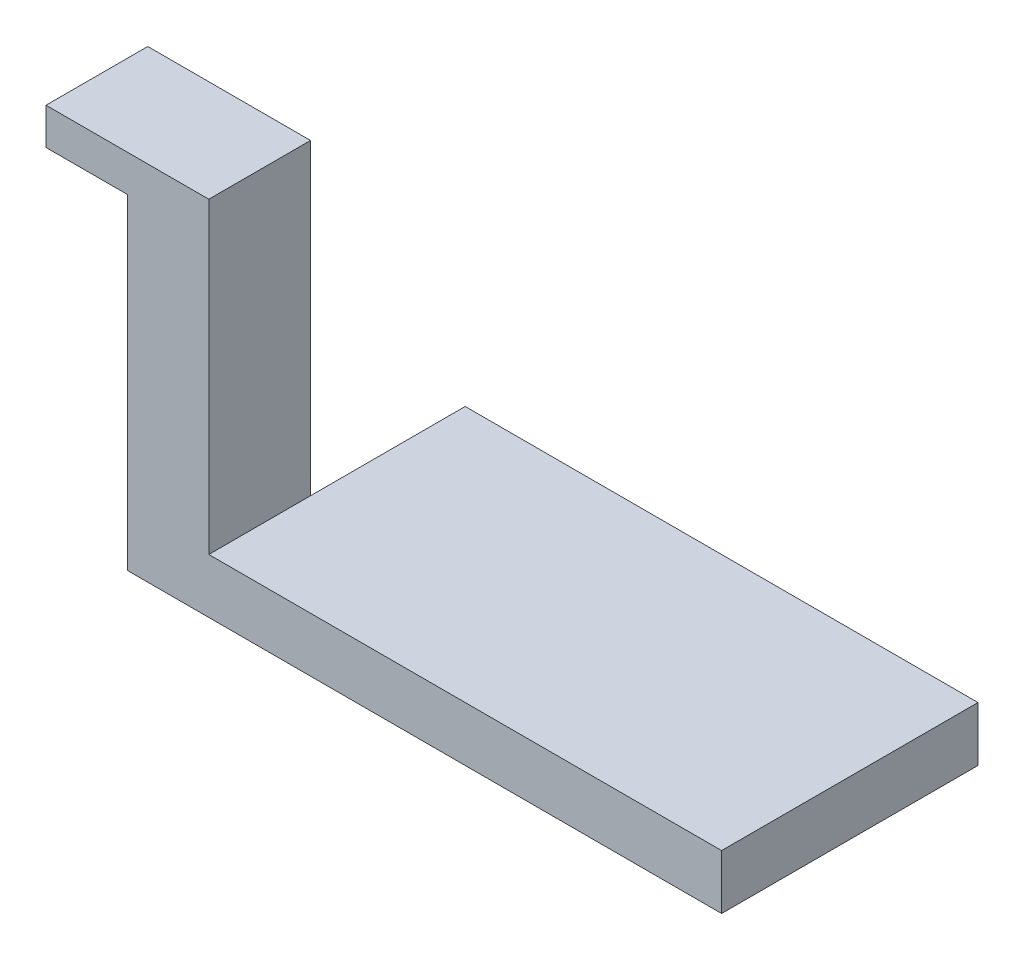
from build123d import *

# Parameters (mm, degrees)
SKETCH1_W           = 10.16
SKETCH1_H           = 6.35
BOSS_EXTRUDE1_DEPTH = 2.286
SKETCH2_W           = 5.842
SKETCH2_H           = 1.651
CUT_EXTRUDE1_DEPTH  = 8.89
SKETCH3_W           = 5.08
SKETCH3_H           = 6.35
BOSS_EXTRUDE2_DEPTH = 20.32
SKETCH4_W           = 16.002
SKETCH4_H           = 3.4036
BOSS_EXTRUDE3_DEPTH = 32.004


with BuildPart() as part:
    # Sketch1 → Boss-Extrude1 (new body)
    with BuildSketch(Plane(origin=(0, 0, 0), x_dir=(1, 0, 0), z_dir=(0, 1, 0))):
        with Locations((5.08, 3.175)):
            Rectangle(SKETCH1_W, SKETCH1_H)
    extrude(amount=BOSS_EXTRUDE1_DEPTH)

    # Sketch2 → Cut-Extrude1 (cut)
    with BuildSketch(Plane.ZY):
        with Locations((-3.1242, 1.1557)):
            Rectangle(SKETCH2_W, SKETCH2_H)
    extrude(amount=-CUT_EXTRUDE1_DEPTH, mode=Mode.SUBTRACT)

    # Sketch3 → Boss-Extrude2 (add)
    with BuildSketch(Plane.XZ):
        with Locations((7.62, -3.175)):
            Rectangle(SKETCH3_W, SKETCH3_H)
    extrude(amount=BOSS_EXTRUDE2_DEPTH)

    # Sketch4 → Boss-Extrude3 (add)
    with BuildSketch(Plane(origin=(10.16, 0, 0), x_dir=(0, 0, -1), z_dir=(1, 0, 0))):
        with Locations((8.001, -18.6182)):
            Rectangle(SKETCH4_W, SKETCH4_H)
    extrude(amount=BOSS_EXTRUDE3_DEPTH)


solid = part.part
